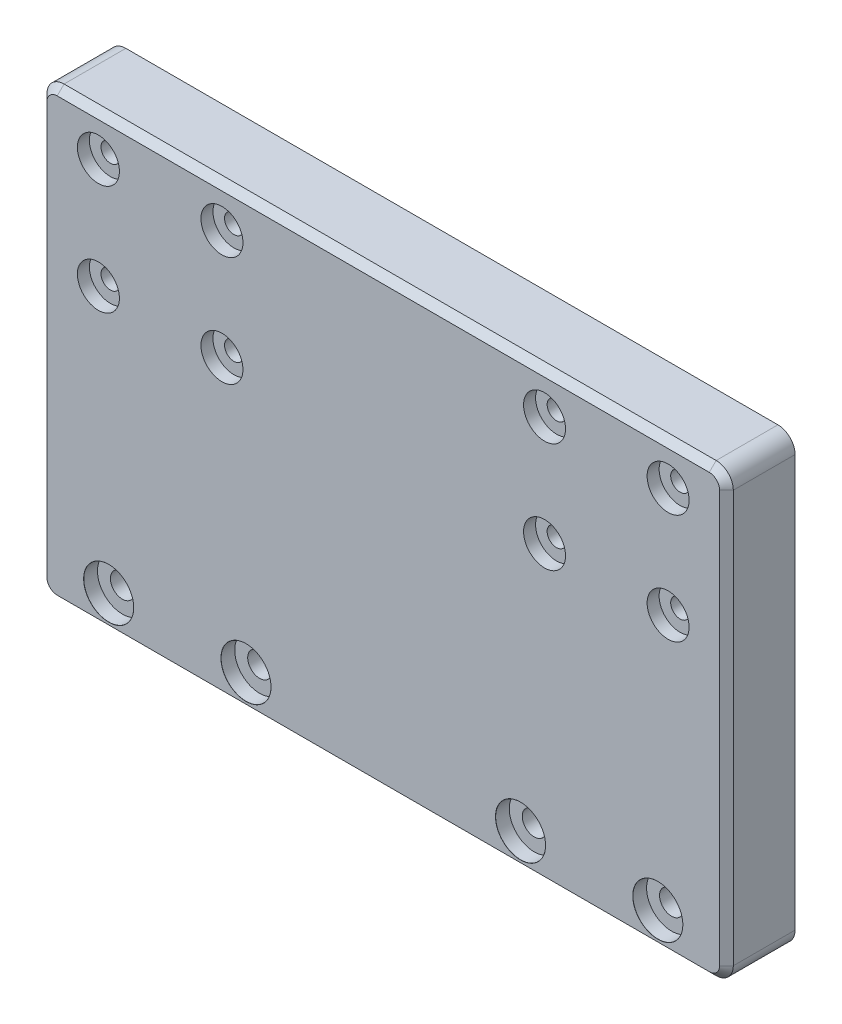
from build123d import *

# Parameters (mm, degrees)
SKETCH1_W                               = 200
SKETCH1_H                               = 130
BOSS_EXTRUDE1_DEPTH                     = 20
FILLET1_R                               = 5
CBORE_FOR_M6_HEX_HEAD_BOLT2_AT_2_COUNT  = 2
CBORE_FOR_M6_HEX_HEAD_BOLT2_AT_2_PITCH  = 40
CBORE_FOR_M6_HEX_HEAD_BOLT2_AT_3_COUNT  = 2
CBORE_FOR_M6_HEX_HEAD_BOLT2_AT_3_PITCH  = 120
CBORE_FOR_M6_HEX_HEAD_BOLT2_AT_4_COUNT  = 2
CBORE_FOR_M6_HEX_HEAD_BOLT2_AT_4_PITCH  = 160
CBORE_FOR_M5_HEX_HEAD_BOLT1_D           = 5.5
CBORE_FOR_M5_HEX_HEAD_BOLT1_CBORE_D     = 12.238
CBORE_FOR_M5_HEX_HEAD_BOLT1_CBORE_DEPTH = 3.5
CHAMFER1_SIZE                           = 2


with BuildPart() as part:
    # Sketch1 → Boss-Extrude1 (new body)
    with BuildSketch(Plane.XY):
        with Locations((100, 65)):
            Rectangle(SKETCH1_W, SKETCH1_H)
    extrude(amount=BOSS_EXTRUDE1_DEPTH)

    # Fillet1
    fillet1_edges = [part.edges().sort_by_distance(p)[0] for p in [
        (0, 130, 10),
        (200, 130, 10),
        (200, 0, 10),
        (0, 0, 10),
    ]]
    fillet(fillet1_edges, radius=FILLET1_R)

    # Sketch17 → CBORE for M6 Hex Head Bolt2 (revolve, cut)
    with BuildSketch(Plane(origin=(20, 10, 20), x_dir=(0, -1, 0), z_dir=(1, 0, 0))):
        Polygon((0, 0), (0, 20), (3.5, 20), (3.5, 4), (7.2735, 4), (7.2735, 0.025), (7.2985, 0), align=None)
    cbore_for_m6_hex_head_bolt2 = revolve(axis=Axis((20, 10, 26.35), (0, 0, -1)), mode=Mode.SUBTRACT)

    # CBORE for M6 Hex Head Bolt2 at 2: CBORE for M6 Hex Head Bolt2 ×2
    with Locations(*[(i * CBORE_FOR_M6_HEX_HEAD_BOLT2_AT_2_PITCH, 0, 0) for i in range(1, CBORE_FOR_M6_HEX_HEAD_BOLT2_AT_2_COUNT)]):
        add(cbore_for_m6_hex_head_bolt2, mode=Mode.SUBTRACT)

    # CBORE for M6 Hex Head Bolt2 at 3: CBORE for M6 Hex Head Bolt2 ×2
    with Locations(*[(i * CBORE_FOR_M6_HEX_HEAD_BOLT2_AT_3_PITCH, 0, 0) for i in range(1, CBORE_FOR_M6_HEX_HEAD_BOLT2_AT_3_COUNT)]):
        add(cbore_for_m6_hex_head_bolt2, mode=Mode.SUBTRACT)

    # CBORE for M6 Hex Head Bolt2 at 4: CBORE for M6 Hex Head Bolt2 ×2
    with Locations(*[(i * CBORE_FOR_M6_HEX_HEAD_BOLT2_AT_4_PITCH, 0, 0) for i in range(1, CBORE_FOR_M6_HEX_HEAD_BOLT2_AT_4_COUNT)]):
        add(cbore_for_m6_hex_head_bolt2, mode=Mode.SUBTRACT)

    # CBORE for M5 Hex Head Bolt1 (through all)
    with Locations(Plane.XY.offset(20)):
        with Locations((17, 118), (53, 118), (53, 86), (17, 86), (183, 118), (183, 86), (147, 118), (147, 86)):
            CounterBoreHole(CBORE_FOR_M5_HEX_HEAD_BOLT1_D / 2, CBORE_FOR_M5_HEX_HEAD_BOLT1_CBORE_D / 2, CBORE_FOR_M5_HEX_HEAD_BOLT1_CBORE_DEPTH)

    # Chamfer1
    chamfer1_edges = [part.edges().sort_by_distance(p)[0] for p in [
        (100, 130, 20),
        (200, 65, 20),
        (0, 65, 20),
        (100, 0, 20),
        (1.464466094, 128.535533906, 20),
        (1.464466094, 1.464466094, 20),
        (198.535533906, 1.464466094, 20),
        (198.535533906, 128.535533906, 20),
    ]]
    chamfer(chamfer1_edges, length=CHAMFER1_SIZE)


solid = part.part
